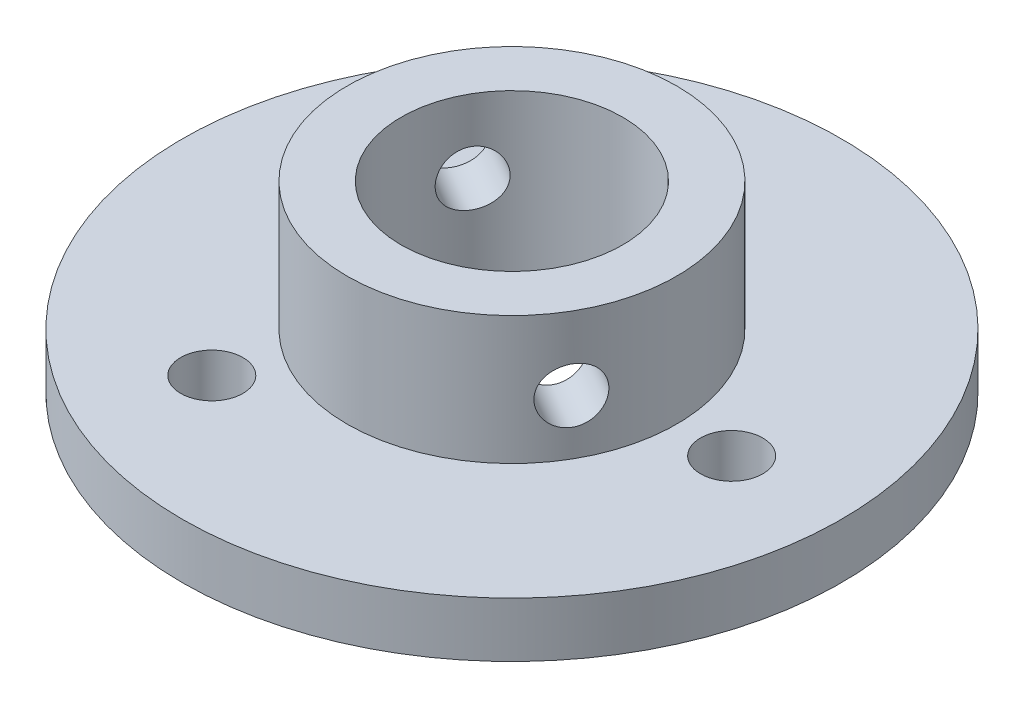
from build123d import *

# Parameters (mm, degrees)
HUB_NECK_SKETCH_R                   = 9
HUB_NECK_DEPTH                      = 10
RIM_CLAMP_FLANGE_SKETCH_R           = 18
RIM_CLAMP_FLANGE_DEPTH              = 3
AXLE_CLEARANCE_SKETCH_R             = 6.05
AXLE_CLEARANCE_DEPTH                = 10.2
RIM_BOLT_CLEARANCE_PATTERN_SKETCH_R = 1.7
RIM_BOLT_CLEARANCE_PATTERN_DEPTH    = 3.2
POSITIVE_HUB_PIN_BORE_SKETCH_R      = 1.5
POSITIVE_HUB_PIN_BORE_DEPTH         = 20


with BuildPart() as part:
    # Hub neck sketch → Hub neck (new body)
    with BuildSketch(Plane(origin=(0, -273, 0), x_dir=(1, 0, 0), z_dir=(0, 1, 0))):
        with Locations(Location((-19.009182883, 53.244882879, 0), (0, 0, 270))):
            Circle(HUB_NECK_SKETCH_R)
    extrude(amount=HUB_NECK_DEPTH)

    # Rim clamp flange sketch → Rim clamp flange (add)
    with BuildSketch(Plane(origin=(0, -266, 0), x_dir=(1, 0, 0), z_dir=(0, 1, 0))):
        with Locations(Location((-19.009182883, 53.244882879, 0), (0, 0, 270))):
            Circle(RIM_CLAMP_FLANGE_SKETCH_R)
    extrude(amount=RIM_CLAMP_FLANGE_DEPTH)

    # Axle clearance sketch → Axle clearance (cut)
    with BuildSketch(Plane(origin=(0, -273.1, 0), x_dir=(1, 0, 0), z_dir=(0, 1, 0))):
        with Locations(Location((-19.009182883, 53.244882879, 0), (0, 0, 270))):
            Circle(AXLE_CLEARANCE_SKETCH_R)
    extrude(amount=AXLE_CLEARANCE_DEPTH, mode=Mode.SUBTRACT)

    # Rim bolt clearance pattern sketch → Rim bolt clearance pattern (cut)
    with BuildSketch(Plane(origin=(0, -266.1, 0), x_dir=(1, 0, 0), z_dir=(0, 1, 0))):
        with Locations(Location((-7.009182883, 53.244882879, 0), (0, 0, 270))):
            Circle(RIM_BOLT_CLEARANCE_PATTERN_SKETCH_R)
        with Locations(Location((-25.009182883, 42.852578033, 0), (0, 0, 270))):
            Circle(RIM_BOLT_CLEARANCE_PATTERN_SKETCH_R)
        with Locations(Location((-25.009182883, 63.637187724, 0), (0, 0, 270))):
            Circle(RIM_BOLT_CLEARANCE_PATTERN_SKETCH_R)
    extrude(amount=RIM_BOLT_CLEARANCE_PATTERN_DEPTH, mode=Mode.SUBTRACT)

    # Positive hub pin bore sketch → Positive hub pin bore (cut)
    with BuildSketch(Plane(origin=(-45.972851797, 0, -26.542438361), x_dir=(0.5000000000000001, 0, -0.8660254037844386), z_dir=(0.8660254037844386, 0, 0.5000000000000001))):
        with Locations(Location((36.606829753, -269, 0), (0, 0, 180))):
            Circle(POSITIVE_HUB_PIN_BORE_SKETCH_R)
    extrude(amount=POSITIVE_HUB_PIN_BORE_DEPTH, mode=Mode.SUBTRACT)


with BuildPart() as body_2:
    # Mirror1: mirrored copy
    add(part.part.mirror(Plane(origin=(0, 0, 0), x_dir=(0, 0, 1), z_dir=(0, -1, 0))))


solid = body_2.part
